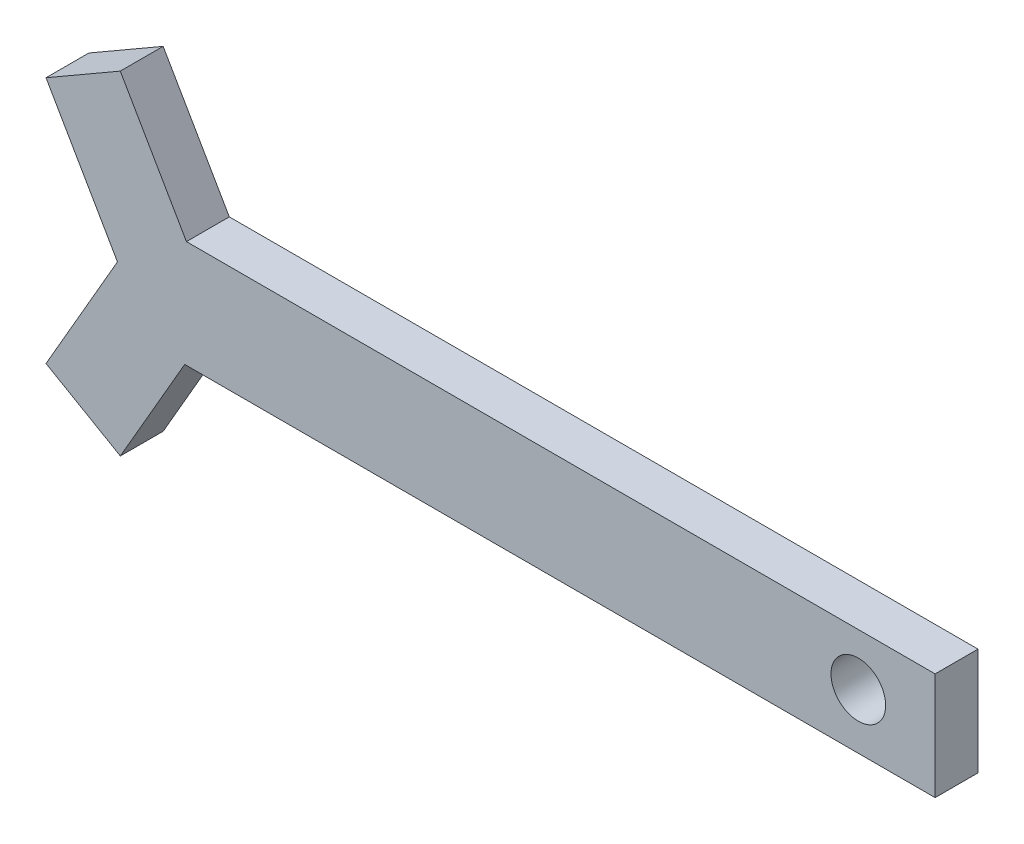
from build123d import *

# Parameters (mm, degrees)
ESBO_O1_R                = 2.55
RESSALTO_EXTRUS_O1_DEPTH = 4


with BuildPart() as part:
    # Esboço1 → Ressalto-extrusão1 (new body)
    with BuildSketch(Plane.XY):
        Polygon((52.704190952, -2.400470185), (-17.136160755, -2.400470185), (-23.307642689, 8.288850082), (-30.235845919, 4.288850082), (-23.57078241, -7.255378552), (-30.235845919, -18.799607186), (-23.301725869, -22.803023264), (-17.295809048, -12.400470185), (52.704190952, -12.400470185), align=None)
        with Locations((45.538806525, -7.255378552)):
            Circle(ESBO_O1_R, mode=Mode.SUBTRACT)
    extrude(amount=RESSALTO_EXTRUS_O1_DEPTH)


solid = part.part
